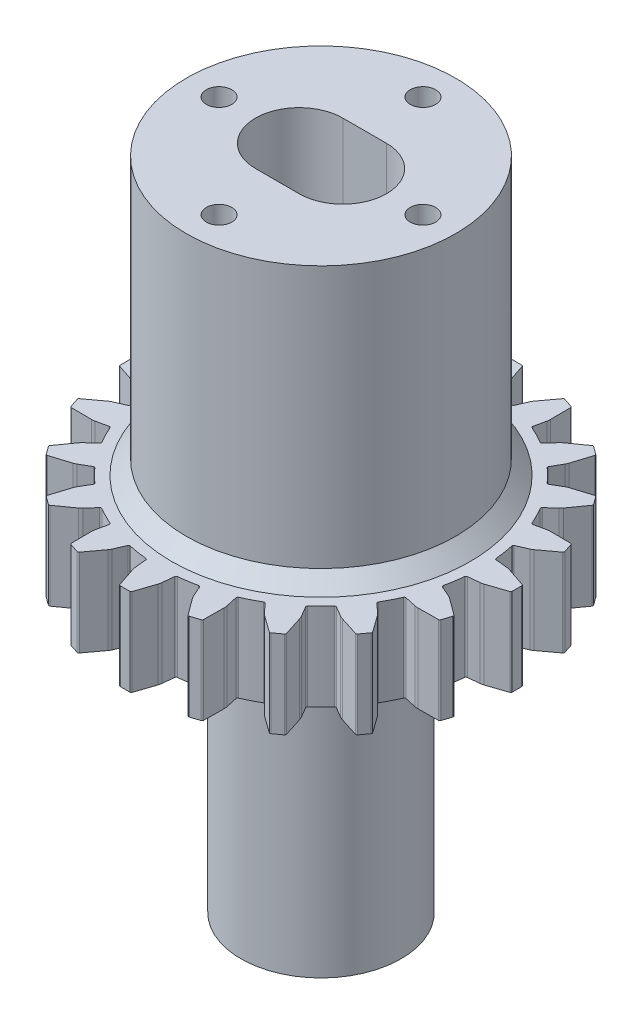
from build123d import *

# Parameters (mm, degrees)
BOSS_EXTRUDE1_DEPTH     = 6
SKETCH2_R               = 8.5
SKETCH2_R_2             = 5.5
CUT_EXTRUDE1_DEPTH      = 4.5
SKETCH3_R               = 9.25
BOSS_EXTRUDE2_DEPTH     = 19
SKETCH4_R               = 0.875
CUT_EXTRUDE2_DEPTH      = 15
SKETCH7_R               = 5.5
SKETCH8_R               = 5.5
CUT_EXTRUDE5_DEPTH      = 32.417264545
CUT_EXTRUDE5_DEPTH_BACK = 32.417264545
CHAMFER2_SIZE           = 1


with BuildPart() as part:
    # Sketch1 → Boss-Extrude1 (new body)
    with BuildSketch(Plane(origin=(0, 0, 0), x_dir=(1, 0, 0), z_dir=(0, 1, 0))):
        with BuildLine():
            Line((-0.991817968, 11.03627147), (-0.911094624, 11.843504907))
            ThreePointArc((-0.911094624, 11.843504907), (-0.893940179, 11.953155049), (-0.864740732, 12.060228954))
            Line((-0.864740732, 12.060228954), (-0.422792408, 13.386073927))
            ThreePointArc((-0.422792408, 13.386073927), (-0.386395106, 13.435575369), (-0.327924078, 13.45445115))
            Line((-0.327924078, 13.45445115), (0.327924078, 13.45445115))
            ThreePointArc((0.327924078, 13.45445115), (0.386395106, 13.435575369), (0.422792408, 13.386073927))
            Line((0.422792408, 13.386073927), (0.864740732, 12.060228954))
            ThreePointArc((0.864740732, 12.060228954), (0.893940179, 11.953155049), (0.911094624, 11.843504907))
            Line((0.911094624, 11.843504907), (0.991817968, 11.03627147))
            ThreePointArc((0.991817968, 11.03627147), (1.020653176, 10.975469022), (1.08148996, 10.94670633))
            ThreePointArc((1.08148996, 10.94670633), (1.720779115, 10.864571747), (2.354160214, 10.745135164))
            ThreePointArc((2.354160214, 10.745135164), (2.420907596, 10.753690509), (2.467120497, 10.802606504))
            Line((2.467120497, 10.802606504), (2.79334181, 11.54538624))
            ThreePointArc((2.79334181, 11.54538624), (2.843540414, 11.644368707), (2.904398394, 11.737178916))
            Line((2.904398394, 11.737178916), (3.734424857, 12.861562875))
            ThreePointArc((3.734424857, 12.861562875), (3.784337534, 12.897394159), (3.845779724, 12.897277552))
            Line((3.845779724, 12.897277552), (4.469528387, 12.694609327))
            ThreePointArc((4.469528387, 12.694609327), (4.519304702, 12.65858885), (4.538623806, 12.600262796))
            Line((4.538623806, 12.600262796), (4.549233011, 11.202739752))
            ThreePointArc((4.549233011, 11.202739752), (4.543915679, 11.091883292), (4.526346769, 10.982298795))
            Line((4.526346769, 10.982298795), (4.35367038, 10.189629289))
            ThreePointArc((4.35367038, 10.189629289), (4.362305303, 10.122892156), (4.411276362, 10.07673761))
            ThreePointArc((4.411276362, 10.07673761), (4.993895497, 9.801071766), (5.559368785, 9.491755302))
            ThreePointArc((5.559368785, 9.491755302), (5.625493064, 9.479265844), (5.684560019, 9.511507148))
            Line((5.684560019, 9.511507148), (6.224346485, 10.117124726))
            ThreePointArc((6.224346485, 10.117124726), (6.30267546, 10.195750424), (6.38923477, 10.265212029))
            Line((6.38923477, 10.265212029), (7.526090597, 11.078072437))
            ThreePointArc((7.526090597, 11.078072437), (7.58463285, 11.096726148), (7.643031812, 11.077628567))
            Line((7.643031812, 11.077628567), (8.173624116, 10.692130694))
            ThreePointArc((8.173624116, 10.692130694), (8.209833265, 10.642491457), (8.210183083, 10.581050153))
            Line((8.210183083, 10.581050153), (7.788414666, 9.24864833))
            ThreePointArc((7.788414666, 9.24864833), (7.749101053, 9.144860717), (7.698528554, 9.046068759))
            Line((7.698528554, 9.046068759), (7.289355202, 8.345555199))
            ThreePointArc((7.289355202, 8.345555199), (7.276944593, 8.279416076), (7.309256299, 8.220387604))
            ThreePointArc((7.309256299, 8.220387604), (7.778174593, 7.778174593), (8.220387604, 7.309256299))
            ThreePointArc((8.220387604, 7.309256299), (8.279416076, 7.276944593), (8.345555199, 7.289355202))
            Line((8.345555199, 7.289355202), (9.046068759, 7.698528554))
            ThreePointArc((9.046068759, 7.698528554), (9.144860717, 7.749101053), (9.24864833, 7.788414666))
            Line((9.24864833, 7.788414666), (10.581050153, 8.210183083))
            ThreePointArc((10.581050153, 8.210183083), (10.642491457, 8.209833265), (10.692130694, 8.173624116))
            Line((10.692130694, 8.173624116), (11.077628567, 7.643031812))
            ThreePointArc((11.077628567, 7.643031812), (11.096726148, 7.58463285), (11.078072437, 7.526090597))
            Line((11.078072437, 7.526090597), (10.265212029, 6.38923477))
            ThreePointArc((10.265212029, 6.38923477), (10.195750424, 6.30267546), (10.117124726, 6.224346485))
            Line((10.117124726, 6.224346485), (9.511507148, 5.684560019))
            ThreePointArc((9.511507148, 5.684560019), (9.479265844, 5.625493064), (9.491755302, 5.559368785))
            ThreePointArc((9.491755302, 5.559368785), (9.801071766, 4.993895497), (10.07673761, 4.411276362))
            ThreePointArc((10.07673761, 4.411276362), (10.122892156, 4.362305303), (10.189629289, 4.35367038))
            Line((10.189629289, 4.35367038), (10.982298795, 4.526346769))
            ThreePointArc((10.982298795, 4.526346769), (11.091883292, 4.543915679), (11.202739752, 4.549233011))
            Line((11.202739752, 4.549233011), (12.600262796, 4.538623806))
            ThreePointArc((12.600262796, 4.538623806), (12.65858885, 4.519304702), (12.694609327, 4.469528387))
            Line((12.694609327, 4.469528387), (12.897277552, 3.845779724))
            ThreePointArc((12.897277552, 3.845779724), (12.897394159, 3.784337534), (12.861562875, 3.734424857))
            Line((12.861562875, 3.734424857), (11.737178916, 2.904398394))
            ThreePointArc((11.737178916, 2.904398394), (11.644368707, 2.843540414), (11.54538624, 2.79334181))
            Line((11.54538624, 2.79334181), (10.802606504, 2.467120497))
            ThreePointArc((10.802606504, 2.467120497), (10.753690509, 2.420907596), (10.745135164, 2.354160214))
            ThreePointArc((10.745135164, 2.354160214), (10.864571747, 1.720779115), (10.94670633, 1.08148996))
            ThreePointArc((10.94670633, 1.08148996), (10.975469022, 1.020653176), (11.03627147, 0.991817968))
            Line((11.03627147, 0.991817968), (11.843504907, 0.911094624))
            ThreePointArc((11.843504907, 0.911094624), (11.953155049, 0.893940179), (12.060228954, 0.864740732))
            Line((12.060228954, 0.864740732), (13.386073927, 0.422792408))
            ThreePointArc((13.386073927, 0.422792408), (13.435575369, 0.386395106), (13.45445115, 0.327924078))
            Line((13.45445115, 0.327924078), (13.45445115, -0.327924078))
            ThreePointArc((13.45445115, -0.327924078), (13.435575369, -0.386395106), (13.386073927, -0.422792408))
            Line((13.386073927, -0.422792408), (12.060228954, -0.864740732))
            ThreePointArc((12.060228954, -0.864740732), (11.953155049, -0.893940179), (11.843504907, -0.911094624))
            Line((11.843504907, -0.911094624), (11.03627147, -0.991817968))
            ThreePointArc((11.03627147, -0.991817968), (10.975469022, -1.020653176), (10.94670633, -1.08148996))
            ThreePointArc((10.94670633, -1.08148996), (10.864571747, -1.720779115), (10.745135164, -2.354160214))
            ThreePointArc((10.745135164, -2.354160214), (10.753690509, -2.420907596), (10.802606504, -2.467120497))
            Line((10.802606504, -2.467120497), (11.54538624, -2.79334181))
            ThreePointArc((11.54538624, -2.79334181), (11.644368707, -2.843540414), (11.737178916, -2.904398394))
            Line((11.737178916, -2.904398394), (12.861562875, -3.734424857))
            ThreePointArc((12.861562875, -3.734424857), (12.897394159, -3.784337534), (12.897277552, -3.845779724))
            Line((12.897277552, -3.845779724), (12.694609327, -4.469528387))
            ThreePointArc((12.694609327, -4.469528387), (12.65858885, -4.519304702), (12.600262796, -4.538623806))
            Line((12.600262796, -4.538623806), (11.202739752, -4.549233011))
            ThreePointArc((11.202739752, -4.549233011), (11.091883292, -4.543915679), (10.982298795, -4.526346769))
            Line((10.982298795, -4.526346769), (10.189629289, -4.35367038))
            ThreePointArc((10.189629289, -4.35367038), (10.122892156, -4.362305303), (10.07673761, -4.411276362))
            ThreePointArc((10.07673761, -4.411276362), (9.801071766, -4.993895497), (9.491755302, -5.559368785))
            ThreePointArc((9.491755302, -5.559368785), (9.479265844, -5.625493064), (9.511507148, -5.684560019))
            Line((9.511507148, -5.684560019), (10.117124726, -6.224346485))
            ThreePointArc((10.117124726, -6.224346485), (10.195750424, -6.30267546), (10.265212029, -6.38923477))
            Line((10.265212029, -6.38923477), (11.078072437, -7.526090597))
            ThreePointArc((11.078072437, -7.526090597), (11.096726148, -7.58463285), (11.077628567, -7.643031812))
            Line((11.077628567, -7.643031812), (10.692130694, -8.173624116))
            ThreePointArc((10.692130694, -8.173624116), (10.642491457, -8.209833265), (10.581050153, -8.210183083))
            Line((10.581050153, -8.210183083), (9.24864833, -7.788414666))
            ThreePointArc((9.24864833, -7.788414666), (9.144860717, -7.749101053), (9.046068759, -7.698528554))
            Line((9.046068759, -7.698528554), (8.345555199, -7.289355202))
            ThreePointArc((8.345555199, -7.289355202), (8.279416076, -7.276944593), (8.220387604, -7.309256299))
            ThreePointArc((8.220387604, -7.309256299), (7.778174593, -7.778174593), (7.309256299, -8.220387604))
            ThreePointArc((7.309256299, -8.220387604), (7.276944593, -8.279416076), (7.289355202, -8.345555199))
            Line((7.289355202, -8.345555199), (7.698528554, -9.046068759))
            ThreePointArc((7.698528554, -9.046068759), (7.749101053, -9.144860717), (7.788414666, -9.24864833))
            Line((7.788414666, -9.24864833), (8.210183083, -10.581050153))
            ThreePointArc((8.210183083, -10.581050153), (8.209833265, -10.642491457), (8.173624116, -10.692130694))
            Line((8.173624116, -10.692130694), (7.643031812, -11.077628567))
            ThreePointArc((7.643031812, -11.077628567), (7.58463285, -11.096726148), (7.526090597, -11.078072437))
            Line((7.526090597, -11.078072437), (6.38923477, -10.265212029))
            ThreePointArc((6.38923477, -10.265212029), (6.30267546, -10.195750424), (6.224346485, -10.117124726))
            Line((6.224346485, -10.117124726), (5.684560019, -9.511507148))
            ThreePointArc((5.684560019, -9.511507148), (5.625493064, -9.479265844), (5.559368785, -9.491755302))
            ThreePointArc((5.559368785, -9.491755302), (4.993895497, -9.801071766), (4.411276362, -10.07673761))
            ThreePointArc((4.411276362, -10.07673761), (4.362305303, -10.122892156), (4.35367038, -10.189629289))
            Line((4.35367038, -10.189629289), (4.526346769, -10.982298795))
            ThreePointArc((4.526346769, -10.982298795), (4.543915679, -11.091883292), (4.549233011, -11.202739752))
            Line((4.549233011, -11.202739752), (4.538623806, -12.600262796))
            ThreePointArc((4.538623806, -12.600262796), (4.519304702, -12.65858885), (4.469528387, -12.694609327))
            Line((4.469528387, -12.694609327), (3.845779724, -12.897277552))
            ThreePointArc((3.845779724, -12.897277552), (3.784337534, -12.897394159), (3.734424857, -12.861562875))
            Line((3.734424857, -12.861562875), (2.904398394, -11.737178916))
            ThreePointArc((2.904398394, -11.737178916), (2.843540414, -11.644368707), (2.79334181, -11.54538624))
            Line((2.79334181, -11.54538624), (2.467120497, -10.802606504))
            ThreePointArc((2.467120497, -10.802606504), (2.420907596, -10.753690509), (2.354160214, -10.745135164))
            ThreePointArc((2.354160214, -10.745135164), (1.720779115, -10.864571747), (1.08148996, -10.94670633))
            ThreePointArc((1.08148996, -10.94670633), (1.020653176, -10.975469022), (0.991817968, -11.03627147))
            Line((0.991817968, -11.03627147), (0.911094624, -11.843504907))
            ThreePointArc((0.911094624, -11.843504907), (0.893940179, -11.953155049), (0.864740732, -12.060228954))
            Line((0.864740732, -12.060228954), (0.422792408, -13.386073927))
            ThreePointArc((0.422792408, -13.386073927), (0.386395106, -13.435575369), (0.327924078, -13.45445115))
            Line((0.327924078, -13.45445115), (-0.327924078, -13.45445115))
            ThreePointArc((-0.327924078, -13.45445115), (-0.386395106, -13.435575369), (-0.422792408, -13.386073927))
            Line((-0.422792408, -13.386073927), (-0.864740732, -12.060228954))
            ThreePointArc((-0.864740732, -12.060228954), (-0.893940179, -11.953155049), (-0.911094624, -11.843504907))
            Line((-0.911094624, -11.843504907), (-0.991817968, -11.03627147))
            ThreePointArc((-0.991817968, -11.03627147), (-1.020653176, -10.975469022), (-1.08148996, -10.94670633))
            ThreePointArc((-1.08148996, -10.94670633), (-1.720779115, -10.864571747), (-2.354160214, -10.745135164))
            ThreePointArc((-2.354160214, -10.745135164), (-2.420907596, -10.753690509), (-2.467120497, -10.802606504))
            Line((-2.467120497, -10.802606504), (-2.79334181, -11.54538624))
            ThreePointArc((-2.79334181, -11.54538624), (-2.843540414, -11.644368707), (-2.904398394, -11.737178916))
            Line((-2.904398394, -11.737178916), (-3.734424857, -12.861562875))
            ThreePointArc((-3.734424857, -12.861562875), (-3.784337534, -12.897394159), (-3.845779724, -12.897277552))
            Line((-3.845779724, -12.897277552), (-4.469528387, -12.694609327))
            ThreePointArc((-4.469528387, -12.694609327), (-4.519304702, -12.65858885), (-4.538623806, -12.600262796))
            Line((-4.538623806, -12.600262796), (-4.549233011, -11.202739752))
            ThreePointArc((-4.549233011, -11.202739752), (-4.543915679, -11.091883292), (-4.526346769, -10.982298795))
            Line((-4.526346769, -10.982298795), (-4.35367038, -10.189629289))
            ThreePointArc((-4.35367038, -10.189629289), (-4.362305303, -10.122892156), (-4.411276362, -10.07673761))
            ThreePointArc((-4.411276362, -10.07673761), (-4.993895497, -9.801071766), (-5.559368785, -9.491755302))
            ThreePointArc((-5.559368785, -9.491755302), (-5.625493064, -9.479265844), (-5.684560019, -9.511507148))
            Line((-5.684560019, -9.511507148), (-6.224346485, -10.117124726))
            ThreePointArc((-6.224346485, -10.117124726), (-6.30267546, -10.195750424), (-6.38923477, -10.265212029))
            Line((-6.38923477, -10.265212029), (-7.526090597, -11.078072437))
            ThreePointArc((-7.526090597, -11.078072437), (-7.58463285, -11.096726148), (-7.643031812, -11.077628567))
            Line((-7.643031812, -11.077628567), (-8.173624116, -10.692130694))
            ThreePointArc((-8.173624116, -10.692130694), (-8.209833265, -10.642491457), (-8.210183083, -10.581050153))
            Line((-8.210183083, -10.581050153), (-7.788414666, -9.24864833))
            ThreePointArc((-7.788414666, -9.24864833), (-7.749101053, -9.144860717), (-7.698528554, -9.046068759))
            Line((-7.698528554, -9.046068759), (-7.289355202, -8.345555199))
            ThreePointArc((-7.289355202, -8.345555199), (-7.276944593, -8.279416076), (-7.309256299, -8.220387604))
            ThreePointArc((-7.309256299, -8.220387604), (-7.778174593, -7.778174593), (-8.220387604, -7.309256299))
            ThreePointArc((-8.220387604, -7.309256299), (-8.279416076, -7.276944593), (-8.345555199, -7.289355202))
            Line((-8.345555199, -7.289355202), (-9.046068759, -7.698528554))
            ThreePointArc((-9.046068759, -7.698528554), (-9.144860717, -7.749101053), (-9.24864833, -7.788414666))
            Line((-9.24864833, -7.788414666), (-10.581050153, -8.210183083))
            ThreePointArc((-10.581050153, -8.210183083), (-10.642491457, -8.209833265), (-10.692130694, -8.173624116))
            Line((-10.692130694, -8.173624116), (-11.077628567, -7.643031812))
            ThreePointArc((-11.077628567, -7.643031812), (-11.096726148, -7.58463285), (-11.078072437, -7.526090597))
            Line((-11.078072437, -7.526090597), (-10.265212029, -6.38923477))
            ThreePointArc((-10.265212029, -6.38923477), (-10.195750424, -6.30267546), (-10.117124726, -6.224346485))
            Line((-10.117124726, -6.224346485), (-9.511507148, -5.684560019))
            ThreePointArc((-9.511507148, -5.684560019), (-9.479265844, -5.625493064), (-9.491755302, -5.559368785))
            ThreePointArc((-9.491755302, -5.559368785), (-9.801071766, -4.993895497), (-10.07673761, -4.411276362))
            ThreePointArc((-10.07673761, -4.411276362), (-10.122892156, -4.362305303), (-10.189629289, -4.35367038))
            Line((-10.189629289, -4.35367038), (-10.982298795, -4.526346769))
            ThreePointArc((-10.982298795, -4.526346769), (-11.091883292, -4.543915679), (-11.202739752, -4.549233011))
            Line((-11.202739752, -4.549233011), (-12.600262796, -4.538623806))
            ThreePointArc((-12.600262796, -4.538623806), (-12.65858885, -4.519304702), (-12.694609327, -4.469528387))
            Line((-12.694609327, -4.469528387), (-12.897277552, -3.845779724))
            ThreePointArc((-12.897277552, -3.845779724), (-12.897394159, -3.784337534), (-12.861562875, -3.734424857))
            Line((-12.861562875, -3.734424857), (-11.737178916, -2.904398394))
            ThreePointArc((-11.737178916, -2.904398394), (-11.644368707, -2.843540414), (-11.54538624, -2.79334181))
            Line((-11.54538624, -2.79334181), (-10.802606504, -2.467120497))
            ThreePointArc((-10.802606504, -2.467120497), (-10.753690509, -2.420907596), (-10.745135164, -2.354160214))
            ThreePointArc((-10.745135164, -2.354160214), (-10.864571747, -1.720779115), (-10.94670633, -1.08148996))
            ThreePointArc((-10.94670633, -1.08148996), (-10.975469022, -1.020653176), (-11.03627147, -0.991817968))
            Line((-11.03627147, -0.991817968), (-11.843504907, -0.911094624))
            ThreePointArc((-11.843504907, -0.911094624), (-11.953155049, -0.893940179), (-12.060228954, -0.864740732))
            Line((-12.060228954, -0.864740732), (-13.386073927, -0.422792408))
            ThreePointArc((-13.386073927, -0.422792408), (-13.435575369, -0.386395106), (-13.45445115, -0.327924078))
            Line((-13.45445115, -0.327924078), (-13.45445115, 0.327924078))
            ThreePointArc((-13.45445115, 0.327924078), (-13.435575369, 0.386395106), (-13.386073927, 0.422792408))
            Line((-13.386073927, 0.422792408), (-12.060228954, 0.864740732))
            ThreePointArc((-12.060228954, 0.864740732), (-11.953155049, 0.893940179), (-11.843504907, 0.911094624))
            Line((-11.843504907, 0.911094624), (-11.03627147, 0.991817968))
            ThreePointArc((-11.03627147, 0.991817968), (-10.975469022, 1.020653176), (-10.94670633, 1.08148996))
            ThreePointArc((-10.94670633, 1.08148996), (-10.864571747, 1.720779115), (-10.745135164, 2.354160214))
            ThreePointArc((-10.745135164, 2.354160214), (-10.753690509, 2.420907596), (-10.802606504, 2.467120497))
            Line((-10.802606504, 2.467120497), (-11.54538624, 2.79334181))
            ThreePointArc((-11.54538624, 2.79334181), (-11.644368707, 2.843540414), (-11.737178916, 2.904398394))
            Line((-11.737178916, 2.904398394), (-12.861562875, 3.734424857))
            ThreePointArc((-12.861562875, 3.734424857), (-12.897394159, 3.784337534), (-12.897277552, 3.845779724))
            Line((-12.897277552, 3.845779724), (-12.694609327, 4.469528387))
            ThreePointArc((-12.694609327, 4.469528387), (-12.65858885, 4.519304702), (-12.600262796, 4.538623806))
            Line((-12.600262796, 4.538623806), (-11.202739752, 4.549233011))
            ThreePointArc((-11.202739752, 4.549233011), (-11.091883292, 4.543915679), (-10.982298795, 4.526346769))
            Line((-10.982298795, 4.526346769), (-10.189629289, 4.35367038))
            ThreePointArc((-10.189629289, 4.35367038), (-10.122892156, 4.362305303), (-10.07673761, 4.411276362))
            ThreePointArc((-10.07673761, 4.411276362), (-9.801071766, 4.993895497), (-9.491755302, 5.559368785))
            ThreePointArc((-9.491755302, 5.559368785), (-9.479265844, 5.625493064), (-9.511507148, 5.684560019))
            Line((-9.511507148, 5.684560019), (-10.117124726, 6.224346485))
            ThreePointArc((-10.117124726, 6.224346485), (-10.195750424, 6.30267546), (-10.265212029, 6.38923477))
            Line((-10.265212029, 6.38923477), (-11.078072437, 7.526090597))
            ThreePointArc((-11.078072437, 7.526090597), (-11.096726148, 7.58463285), (-11.077628567, 7.643031812))
            Line((-11.077628567, 7.643031812), (-10.692130694, 8.173624116))
            ThreePointArc((-10.692130694, 8.173624116), (-10.642491457, 8.209833265), (-10.581050153, 8.210183083))
            Line((-10.581050153, 8.210183083), (-9.24864833, 7.788414666))
            ThreePointArc((-9.24864833, 7.788414666), (-9.144860717, 7.749101053), (-9.046068759, 7.698528554))
            Line((-9.046068759, 7.698528554), (-8.345555199, 7.289355202))
            ThreePointArc((-8.345555199, 7.289355202), (-8.279416076, 7.276944593), (-8.220387604, 7.309256299))
            ThreePointArc((-8.220387604, 7.309256299), (-7.778174593, 7.778174593), (-7.309256299, 8.220387604))
            ThreePointArc((-7.309256299, 8.220387604), (-7.276944593, 8.279416076), (-7.289355202, 8.345555199))
            Line((-7.289355202, 8.345555199), (-7.698528554, 9.046068759))
            ThreePointArc((-7.698528554, 9.046068759), (-7.749101053, 9.144860717), (-7.788414666, 9.24864833))
            Line((-7.788414666, 9.24864833), (-8.210183083, 10.581050153))
            ThreePointArc((-8.210183083, 10.581050153), (-8.209833265, 10.642491457), (-8.173624116, 10.692130694))
            Line((-8.173624116, 10.692130694), (-7.643031812, 11.077628567))
            ThreePointArc((-7.643031812, 11.077628567), (-7.58463285, 11.096726148), (-7.526090597, 11.078072437))
            Line((-7.526090597, 11.078072437), (-6.38923477, 10.265212029))
            ThreePointArc((-6.38923477, 10.265212029), (-6.30267546, 10.195750424), (-6.224346485, 10.117124726))
            Line((-6.224346485, 10.117124726), (-5.684560019, 9.511507148))
            ThreePointArc((-5.684560019, 9.511507148), (-5.625493064, 9.479265844), (-5.559368785, 9.491755302))
            ThreePointArc((-5.559368785, 9.491755302), (-4.993895497, 9.801071766), (-4.411276362, 10.07673761))
            ThreePointArc((-4.411276362, 10.07673761), (-4.362305303, 10.122892156), (-4.35367038, 10.189629289))
            Line((-4.35367038, 10.189629289), (-4.526346769, 10.982298795))
            ThreePointArc((-4.526346769, 10.982298795), (-4.543915679, 11.091883292), (-4.549233011, 11.202739752))
            Line((-4.549233011, 11.202739752), (-4.538623806, 12.600262796))
            ThreePointArc((-4.538623806, 12.600262796), (-4.519304702, 12.65858885), (-4.469528387, 12.694609327))
            Line((-4.469528387, 12.694609327), (-3.845779724, 12.897277552))
            ThreePointArc((-3.845779724, 12.897277552), (-3.784337534, 12.897394159), (-3.734424857, 12.861562875))
            Line((-3.734424857, 12.861562875), (-2.904398394, 11.737178916))
            ThreePointArc((-2.904398394, 11.737178916), (-2.843540414, 11.644368707), (-2.79334181, 11.54538624))
            Line((-2.79334181, 11.54538624), (-2.467120497, 10.802606504))
            ThreePointArc((-2.467120497, 10.802606504), (-2.420907596, 10.753690509), (-2.354160214, 10.745135164))
            ThreePointArc((-2.354160214, 10.745135164), (-1.720779115, 10.864571747), (-1.08148996, 10.94670633))
            ThreePointArc((-1.08148996, 10.94670633), (-1.020653176, 10.975469022), (-0.991817968, 11.03627147))
        make_face()
    extrude(amount=BOSS_EXTRUDE1_DEPTH)

    # Sketch2 → Cut-Extrude1 (cut)
    with BuildSketch(Plane.XZ):
        with Locations(Location((0, 0, 0), (0, 0, 270))):
            Circle(SKETCH2_R)
        with Locations(Location((0, 0, 0), (0, 0, 270))):
            Circle(SKETCH2_R_2, mode=Mode.SUBTRACT)
    extrude(amount=-CUT_EXTRUDE1_DEPTH, mode=Mode.SUBTRACT)

    # Sketch3 → Boss-Extrude2 (add)
    with BuildSketch(Plane(origin=(0, 6, 0), x_dir=(1, 0, 0), z_dir=(0, 1, 0))):
        with Locations(Location((0, 0, 0), (0, 0, 270))):
            Circle(SKETCH3_R)
    extrude(amount=BOSS_EXTRUDE2_DEPTH)

    # Sketch4 → Cut-Extrude2 (cut)
    with BuildSketch(Plane(origin=(0, 25, 0), x_dir=(1, 0, 0), z_dir=(0, 1, 0))):
        with Locations(Location((0, 7, 0), (0, 0, 270))):
            Circle(SKETCH4_R)
        with Locations(Location((7, 0, 0), (0, 0, 270))):
            Circle(SKETCH4_R)
        with Locations(Location((0, -7, 0), (0, 0, 270))):
            Circle(SKETCH4_R)
        with Locations(Location((-7, 0, 0), (0, 0, 270))):
            Circle(SKETCH4_R)
    extrude(amount=-CUT_EXTRUDE2_DEPTH, mode=Mode.SUBTRACT)

    # Sketch7 → Loft1 section 0
    with BuildSketch(Plane.XZ):
        Circle(SKETCH7_R)
    # Sketch8 → Loft1 section 1
    with BuildSketch(Plane(origin=(0, -20, 0), x_dir=(-1, 0, 0), z_dir=(0, -1, 0))):
        Circle(SKETCH8_R)
    loft()

    # Sketch5 → Cut-Extrude5 (cut, two sides: drawn at the far end of the back side and taken through both)
    with BuildSketch(Plane.XZ.offset(-CUT_EXTRUDE5_DEPTH_BACK)):
        with BuildLine():
            Line((-1.5, 3), (1.5, 3))
            ThreePointArc((1.5, 3), (4.5, 0), (1.5, -3))
            Line((1.5, -3), (-1.5, -3))
            ThreePointArc((-1.5, -3), (-4.5, 0), (-1.5, 3))
        make_face()
    extrude(amount=CUT_EXTRUDE5_DEPTH + CUT_EXTRUDE5_DEPTH_BACK, mode=Mode.SUBTRACT)

    # Chamfer2
    chamfer2_edges = [part.edges().sort_by_distance(p)[0] for p in [
        (0, 6, -9.25),
    ]]
    chamfer(chamfer2_edges, length=CHAMFER2_SIZE)


solid = part.part
